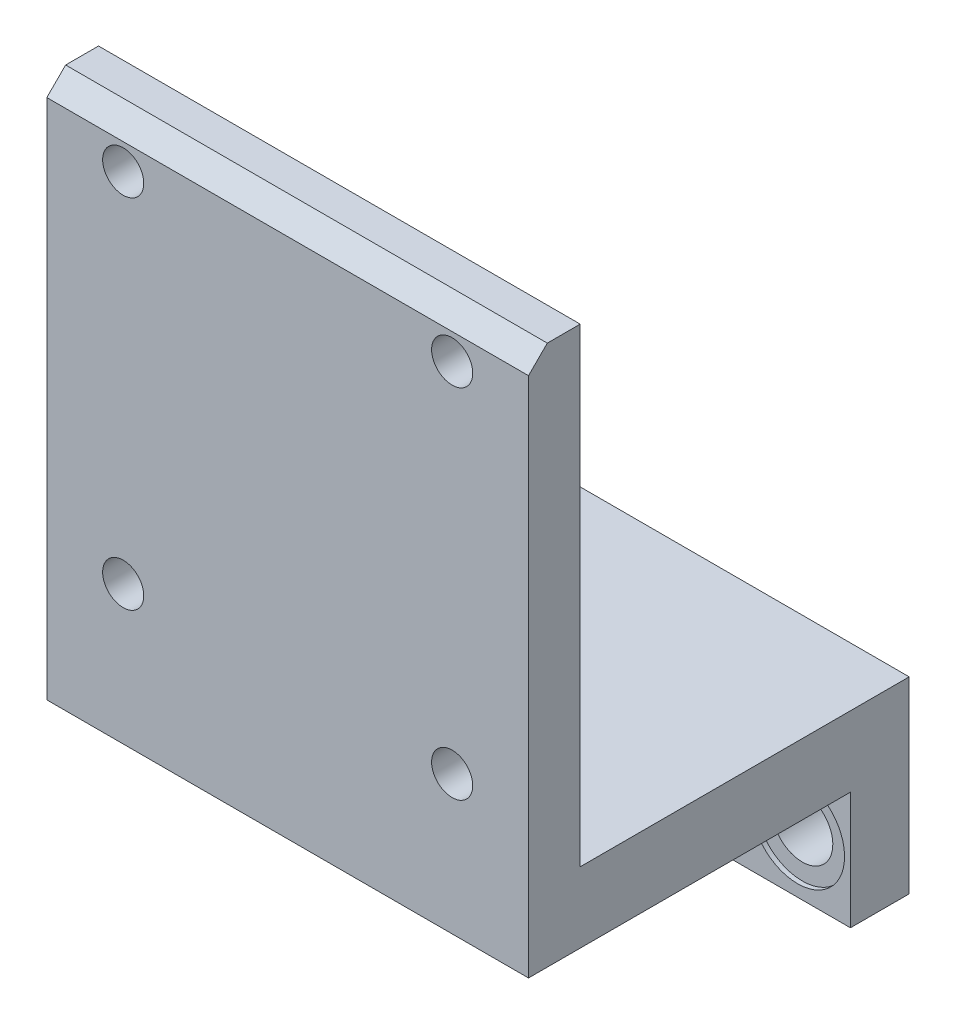
from build123d import *

# Parameters (mm, degrees)
EXTRUDE_1_DEPTH                 = 205
HOLE_WIZARD_M20_1_D             = 17.5
PATTERN_LINEAR_1_COUNT          = 2
PATTERN_LINEAR_1_PITCH          = 140
PATTERN_LINEAR_1_COUNT_DIR2     = 2
PATTERN_LINEAR_1_PITCH_DIR2     = 152
HOLE_WIZARD_M20_1_2_D           = 26
HOLE_WIZARD_M20_1_2_CBORE_D     = 40
HOLE_WIZARD_M20_1_2_CBORE_DEPTH = 2
PATTERN_LINEAR_2_COUNT          = 3
PATTERN_LINEAR_2_PITCH          = 80
CHAMFER_1_SIZE                  = 8


with BuildPart() as part:
    # 草图1 → 凸台-拉伸1 (new body)
    with BuildSketch(Plane(origin=(0, 0, 0), x_dir=(0, 0, -1), z_dir=(1, 0, 0))):
        Polygon((0, 0), (137, 0), (137, -50), (162, -50), (162, 30), (22, 30), (22, 230), (0, 230), align=None)
    extrude(amount=EXTRUDE_1_DEPTH)

    # Hole Wizard M20 _1 (through all)
    with Locations(Plane(origin=(32.5, 211, 0), x_dir=(1, 0, 0), z_dir=(0, 0, 1))):
        with Locations((0, 0)):
            hole_wizard_m20_1 = Hole(HOLE_WIZARD_M20_1_D / 2)

    # 阵列(线性)1: Hole Wizard M20 _1 2 × 2
    with Locations(*[(i * PATTERN_LINEAR_1_PITCH, -j * PATTERN_LINEAR_1_PITCH_DIR2, 0) for i in range(PATTERN_LINEAR_1_COUNT) for j in range(PATTERN_LINEAR_1_COUNT_DIR2) if (i, j) != (0, 0)]):
        add(hole_wizard_m20_1, mode=Mode.SUBTRACT)

    # Hole Wizard M20 _1 2 (through all)
    with Locations(Plane(origin=(22.5, -25, -137), x_dir=(0, 1, 0), z_dir=(0, 0, 1))):
        with Locations((0, 0)):
            hole_wizard_m20_1_2 = CounterBoreHole(HOLE_WIZARD_M20_1_2_D / 2, HOLE_WIZARD_M20_1_2_CBORE_D / 2, HOLE_WIZARD_M20_1_2_CBORE_DEPTH)

    # 阵列(线性)2: Hole Wizard M20 _1 2 ×3
    with Locations(*[(i * PATTERN_LINEAR_2_PITCH, 0, 0) for i in range(1, PATTERN_LINEAR_2_COUNT)]):
        add(hole_wizard_m20_1_2, mode=Mode.SUBTRACT)

    # 倒角1
    chamfer_1_edges = [part.edges().sort_by_distance(p)[0] for p in [
        (102.5, 230, 0),
    ]]
    chamfer(chamfer_1_edges, length=CHAMFER_1_SIZE)


solid = part.part
